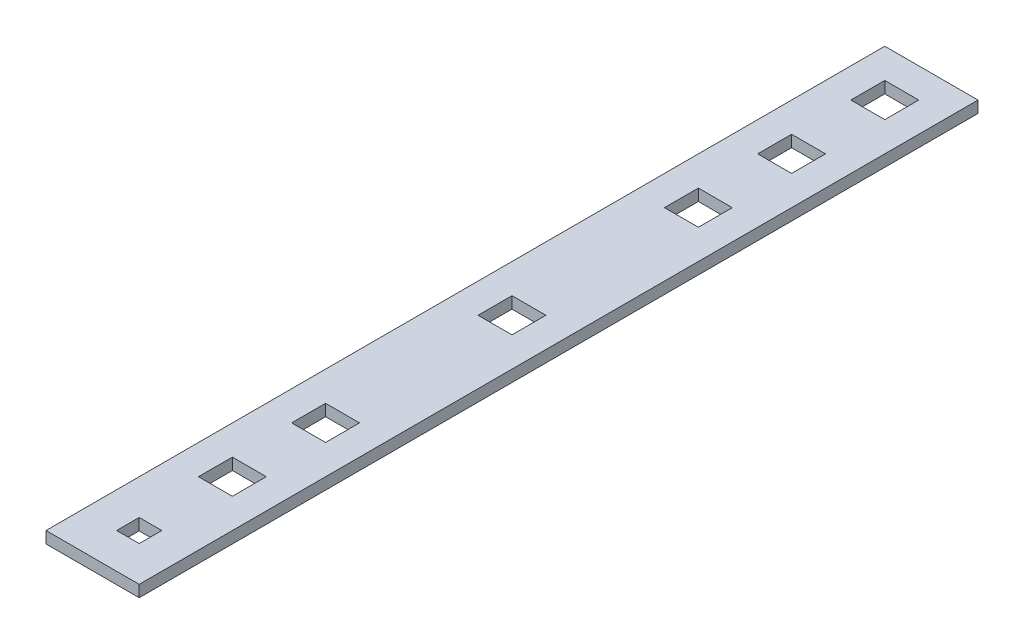
from build123d import *

# Parameters (mm, degrees)
SKETCH1_W           = 12.7
SKETCH1_H           = 114.3
SKETCH1_W_2         = 4.6228
SKETCH1_H_2         = 4.6228
SKETCH1_W_3         = 3.08
SKETCH1_H_3         = 3.08
BOSS_EXTRUDE1_DEPTH = 1.5875


with BuildPart() as part:
    # Sketch1 → Boss-Extrude1 (new body)
    with BuildSketch(Plane(origin=(0, 0, 0), x_dir=(1, 0, 0), z_dir=(0, 1, 0))):
        with Locations((6.35, 44.387542426)):
            Rectangle(SKETCH1_W, SKETCH1_H)
        with Locations((6.3486, 82.486142426)):
            Rectangle(SKETCH1_W_2, SKETCH1_H_2, mode=Mode.SUBTRACT)
        with Locations((6.3486, 95.186142426)):
            Rectangle(SKETCH1_W_2, SKETCH1_H_2, mode=Mode.SUBTRACT)
        with Locations((6.3486, 69.786142426)):
            Rectangle(SKETCH1_W_2, SKETCH1_H_2, mode=Mode.SUBTRACT)
        with Locations((6.3486, 44.386142426)):
            Rectangle(SKETCH1_W_2, SKETCH1_H_2, mode=Mode.SUBTRACT)
        with Locations((6.3486, 18.986142426)):
            Rectangle(SKETCH1_W_2, SKETCH1_H_2, mode=Mode.SUBTRACT)
        with Locations((6.3486, 6.286142426)):
            Rectangle(SKETCH1_W_2, SKETCH1_H_2, mode=Mode.SUBTRACT)
        with Locations((6.35, -6.412457574)):
            Rectangle(SKETCH1_W_3, SKETCH1_H_3, mode=Mode.SUBTRACT)
    extrude(amount=BOSS_EXTRUDE1_DEPTH)


solid = part.part
